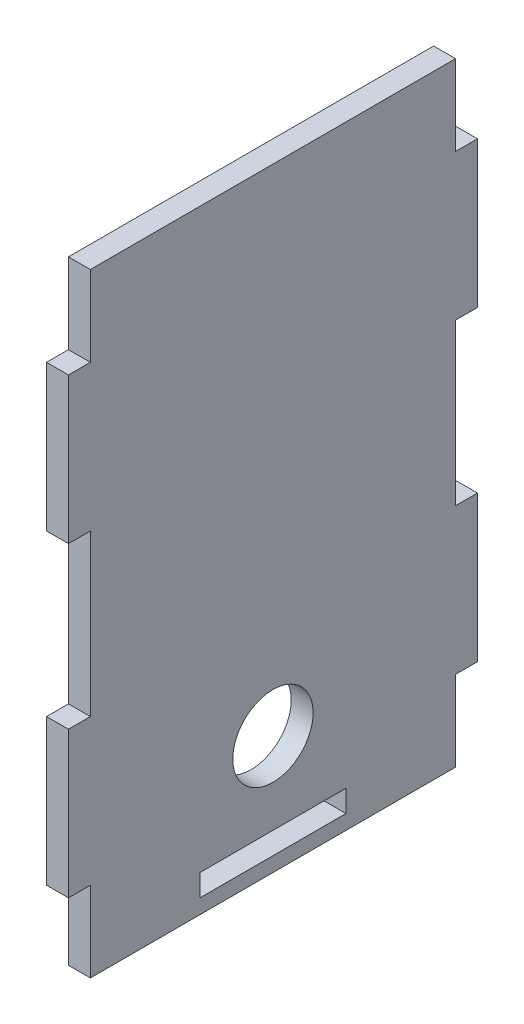
from build123d import *

# Parameters (mm, degrees)
SKETCH1_R           = 5.5
SKETCH1_W           = 20
SKETCH1_H           = 3
BOSS_EXTRUDE2_DEPTH = 3


with BuildPart() as part:
    # Sketch1 → Boss-Extrude2 (new body)
    with BuildSketch(Plane(origin=(0, 0, 0), x_dir=(0, 0, -1), z_dir=(1, 0, 0))):
        Polygon((0, 0), (50, 0), (50, 11), (53, 11), (53, 31), (50, 31), (50, 53), (53, 53), (53, 73), (50, 73), (50, 84), (0, 84), (0, 73), (-3, 73), (-3, 53), (0, 53), (0, 31), (-3, 31), (-3, 11), (0, 11), align=None)
        with Locations((25, 16.2)):
            Circle(SKETCH1_R, mode=Mode.SUBTRACT)
        with Locations((25, 3.5)):
            Rectangle(SKETCH1_W, SKETCH1_H, mode=Mode.SUBTRACT)
    extrude(amount=BOSS_EXTRUDE2_DEPTH)


solid = part.part
